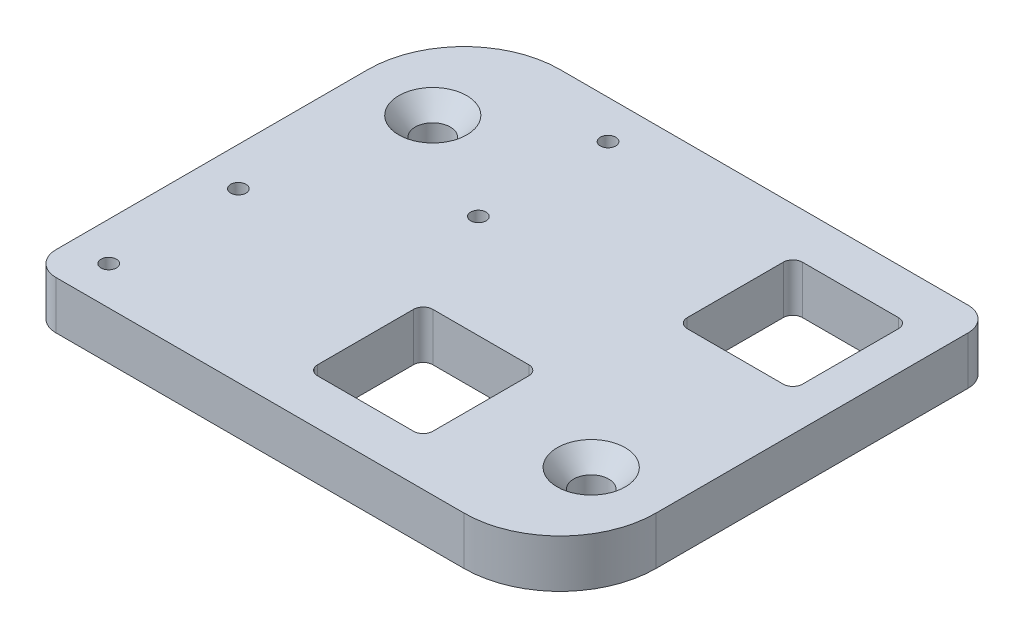
from build123d import *

# Parameters (mm, degrees)
BASE_SKETCH_W               = 55
BASE_SKETCH_H               = 45
BASE_EXTRUDE_DEPTH          = 5
MOSFET_MOUNTING_HOLES_D     = 1.6
MOUNTING_HOLES_D            = 3.6576
MOUNTING_HOLES_CSINK_D      = 7.0866
MOUNTING_HOLES_CSINK_ANGLE  = 82
PIN_RELIEF_SKETCH_W         = 12
PIN_RELIEF_SKETCH_H         = 12
CUT_TERMAL_PIN_RELIEF_DEPTH = 53.974050251
FILLET1_R                   = 10
FILLET2_R                   = 2.5
FILLET3_R                   = 1


with BuildPart() as part:
    # Base Sketch → Base Extrude (new body)
    with BuildSketch(Plane(origin=(0, 0, 0), x_dir=(1, 0, 0), z_dir=(0, 1, 0))):
        with Locations((0, 22.5)):
            Rectangle(BASE_SKETCH_W, BASE_SKETCH_H)
    extrude(amount=-BASE_EXTRUDE_DEPTH)

    # Mosfet Mounting Holes (through all)
    with Locations(Plane(origin=(0, 0, 0), x_dir=(1, 0, 0), z_dir=(0, 1, 0))):
        with Locations((-23.5, 4), (-23.5, 17.5), (-8.5, 27.5), (-8.5, 41)):
            Hole(MOSFET_MOUNTING_HOLES_D / 2)

    # Mounting Holes (through all)
    with Locations(Plane(origin=(0, 0, 0), x_dir=(1, 0, 0), z_dir=(0, 1, 0))):
        with Locations((-20, 34.25), (20, 10.75)):
            CounterSinkHole(MOUNTING_HOLES_D / 2, MOUNTING_HOLES_CSINK_D / 2, counter_sink_angle=MOUNTING_HOLES_CSINK_ANGLE)

    # Pin Relief Sketch → Cut Termal Pin Relief (cut, through all)
    with BuildSketch(Plane(origin=(0, 0, 0), x_dir=(1, 0, 0), z_dir=(0, 1, 0))):
        with Locations((2.5, 10.75)):
            Rectangle(PIN_RELIEF_SKETCH_W, PIN_RELIEF_SKETCH_H)
        with Locations((17.5, 34.25)):
            Rectangle(PIN_RELIEF_SKETCH_W, PIN_RELIEF_SKETCH_H)
    extrude(amount=-CUT_TERMAL_PIN_RELIEF_DEPTH, mode=Mode.SUBTRACT)

    # Fillet1
    fillet1_edges = [part.edges().sort_by_distance(p)[0] for p in [
        (-27.5, -2.5, -45),
        (27.5, -2.5, 0),
    ]]
    fillet(fillet1_edges, radius=FILLET1_R)

    # Fillet2
    fillet2_edges = [part.edges().sort_by_distance(p)[0] for p in [
        (27.5, -2.5, -45),
        (-27.5, -2.5, 0),
    ]]
    fillet(fillet2_edges, radius=FILLET2_R)

    # Fillet3
    fillet3_edges = [part.edges().sort_by_distance(p)[0] for p in [
        (-3.5, -2.5, -4.75),
        (-3.5, -2.5, -16.75),
        (8.5, -2.5, -16.75),
        (8.5, -2.5, -4.75),
        (11.5, -2.5, -28.25),
        (11.5, -2.5, -40.25),
        (23.5, -2.5, -40.25),
        (23.5, -2.5, -28.25),
    ]]
    fillet(fillet3_edges, radius=FILLET3_R)


solid = part.part
